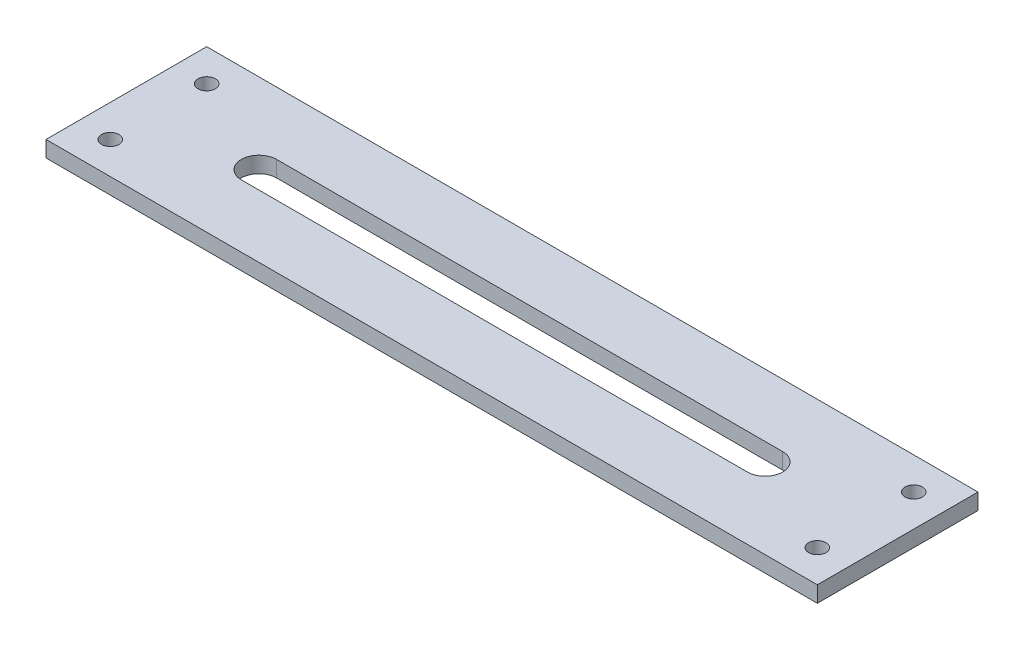
from build123d import *

# Parameters (mm, degrees)
SKETCH1_W           = 304.8
SKETCH1_H           = 63.5
SKETCH1_R           = 3.429
BOSS_EXTRUDE1_DEPTH = 6.35


with BuildPart() as part:
    # Sketch1 → Boss-Extrude1 (new body)
    with BuildSketch(Plane(origin=(0, 0, 0), x_dir=(1, 0, 0), z_dir=(0, 1, 0))):
        Rectangle(SKETCH1_W, SKETCH1_H)
        with Locations(Location((-139.7, 19.05, 0), (0, 0, 270))):
            Circle(SKETCH1_R, mode=Mode.SUBTRACT)
        with Locations(Location((139.7, 19.05, 0), (0, 0, 90))):
            Circle(SKETCH1_R, mode=Mode.SUBTRACT)
        with Locations(Location((139.7, -19.05, 0), (0, 0, 270))):
            Circle(SKETCH1_R, mode=Mode.SUBTRACT)
        with Locations(Location((-139.7, -19.05, 0), (0, 0, 90))):
            Circle(SKETCH1_R, mode=Mode.SUBTRACT)
        with BuildLine():
            Line((-100, 6.985), (100, 6.985))
            ThreePointArc((100, 6.985), (106.985, 0), (100, -6.985))
            Line((100, -6.985), (-100, -6.985))
            ThreePointArc((-100, -6.985), (-106.985, 0), (-100, 6.985))
        make_face(mode=Mode.SUBTRACT)
    extrude(amount=BOSS_EXTRUDE1_DEPTH)


solid = part.part
